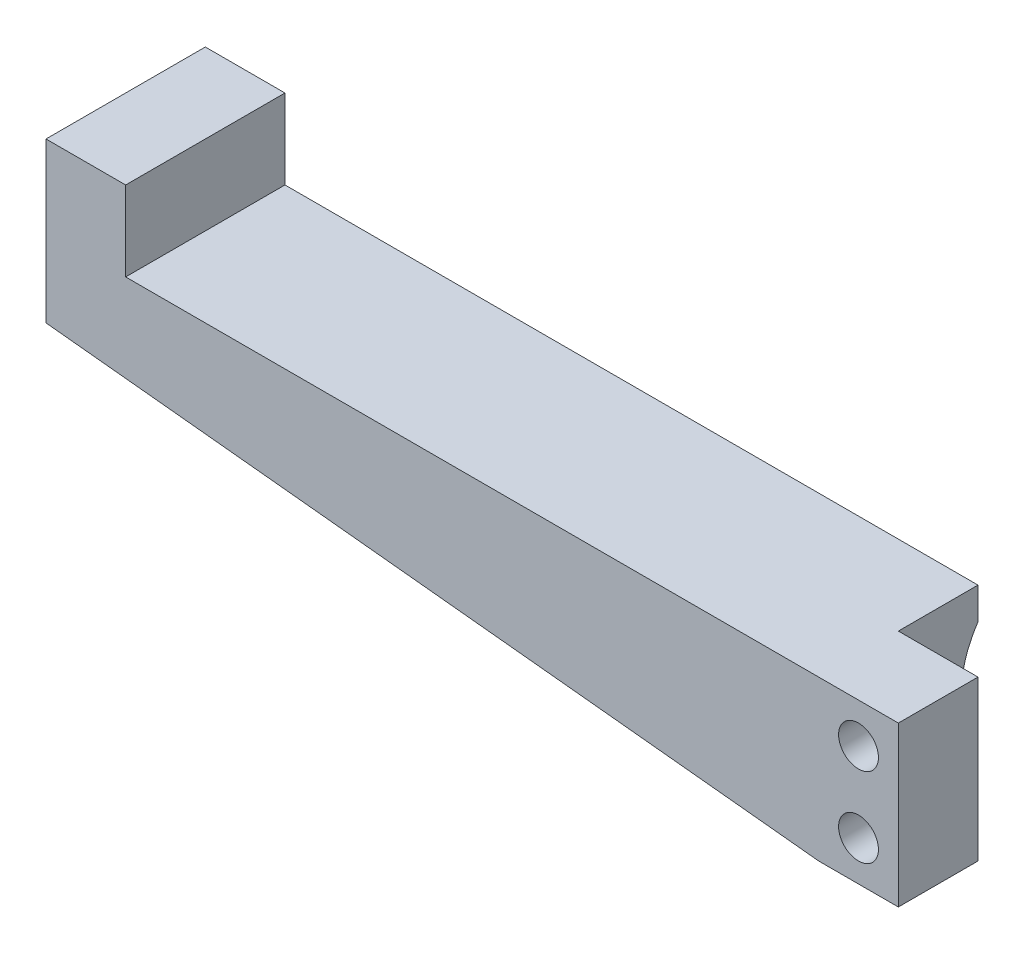
from build123d import *

# Parameters (mm, degrees)
ESQUISSE1_R             = 2.5
BOSS_EXTRU_1_DEPTH      = 20
ESQUISSE3_W             = 10
ESQUISSE3_H             = 20
ENL_V_MAT_EXTRU_2_DEPTH = 10
ENL_V_MAT_EXTRU_3_REACH = 112.675


with BuildPart() as part:
    # Esquisse1 → Boss.-Extru.1 (new body)
    with BuildSketch(Plane.XY):
        Polygon((-102, 0), (-5, -10), (5, -10), (5, 10), (-5, 10), (-92, 10), (-92, 20), (-102, 20), (-102, 10), align=None)
        with Locations((0, 5)):
            Circle(ESQUISSE1_R, mode=Mode.SUBTRACT)
        with Locations((0, -5)):
            Circle(ESQUISSE1_R, mode=Mode.SUBTRACT)
    extrude(amount=BOSS_EXTRU_1_DEPTH)

    # Esquisse3 → Enlèv. mat.-Extru.2 (cut)
    with BuildSketch(Plane(origin=(0, 0, 0), x_dir=(-1, 0, 0), z_dir=(0, 0, -1))):
        Rectangle(ESQUISSE3_W, ESQUISSE3_H)
    extrude(amount=-ENL_V_MAT_EXTRU_2_DEPTH, mode=Mode.SUBTRACT)

    # Enlèv. mat.-Extru.3: up to this face of the body (flat: up to its plane)
    enl_v_mat_extru_3_end = Plane(part.part.faces().sort_by_distance((-5, 0, 5))[0])
    # Esquisse4 → Enlèv. mat.-Extru.3 (cut, up to the picked face)
    with BuildSketch(Plane.ZY.offset(102), mode=Mode.PRIVATE) as enl_v_mat_extru_3_sk1:
        with BuildLine():
            Line((0, 6), (0, -6))
            add(Edge.make_bspline(
                [(0, 6), (4, 0), (0, -6)],
                knots=[0, 0, 0, 1, 1, 1], degree=2))
        make_face()
    enl_v_mat_extru_3_tool1 = split(extrude(enl_v_mat_extru_3_sk1.sketch, amount=-ENL_V_MAT_EXTRU_3_REACH, mode=Mode.PRIVATE), bisect_by=enl_v_mat_extru_3_end, keep=Keep.BOTH, mode=Mode.PRIVATE)
    add(enl_v_mat_extru_3_tool1.solids().sort_by(Axis((-102, 0, 0.8), (1, 0, 0)))[0], mode=Mode.SUBTRACT)


solid = part.part
